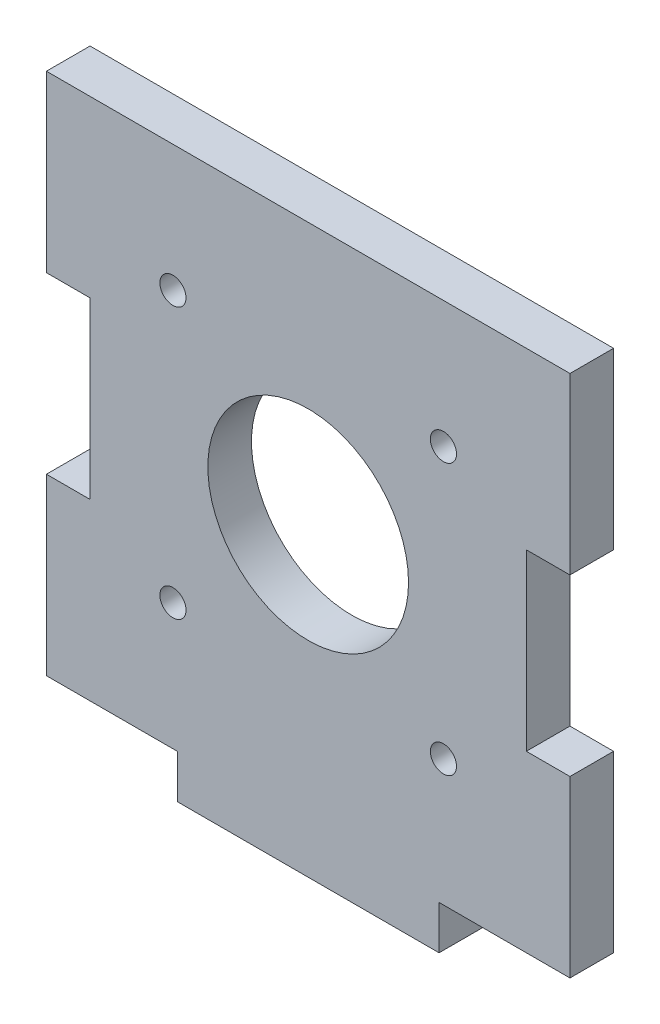
from build123d import *

# Parameters (mm, degrees)
SKETCH_1_R      = 11.5
SKETCH_1_R_2    = 1.5
EXTRUDE_1_DEPTH = 5


with BuildPart() as part:
    # 草图1 → 凸台-拉伸1 (new body)
    with BuildSketch(Plane.XY):
        Polygon((0, 40), (0, 60), (60, 60), (60, 40), (55, 40), (55, 20), (60, 20), (60, 0), (45, 0), (45, -5), (15, -5), (15, 0), (0, 0), (0, 20), (5, 20), (5, 40), align=None)
        with Locations((30, 30)):
            Circle(SKETCH_1_R, mode=Mode.SUBTRACT)
        with Locations((14.5, 45.5)):
            Circle(SKETCH_1_R_2, mode=Mode.SUBTRACT)
        with Locations((45.5, 45.5)):
            Circle(SKETCH_1_R_2, mode=Mode.SUBTRACT)
        with Locations((45.5, 14.5)):
            Circle(SKETCH_1_R_2, mode=Mode.SUBTRACT)
        with Locations((14.5, 14.5)):
            Circle(SKETCH_1_R_2, mode=Mode.SUBTRACT)
    extrude(amount=EXTRUDE_1_DEPTH)


solid = part.part
